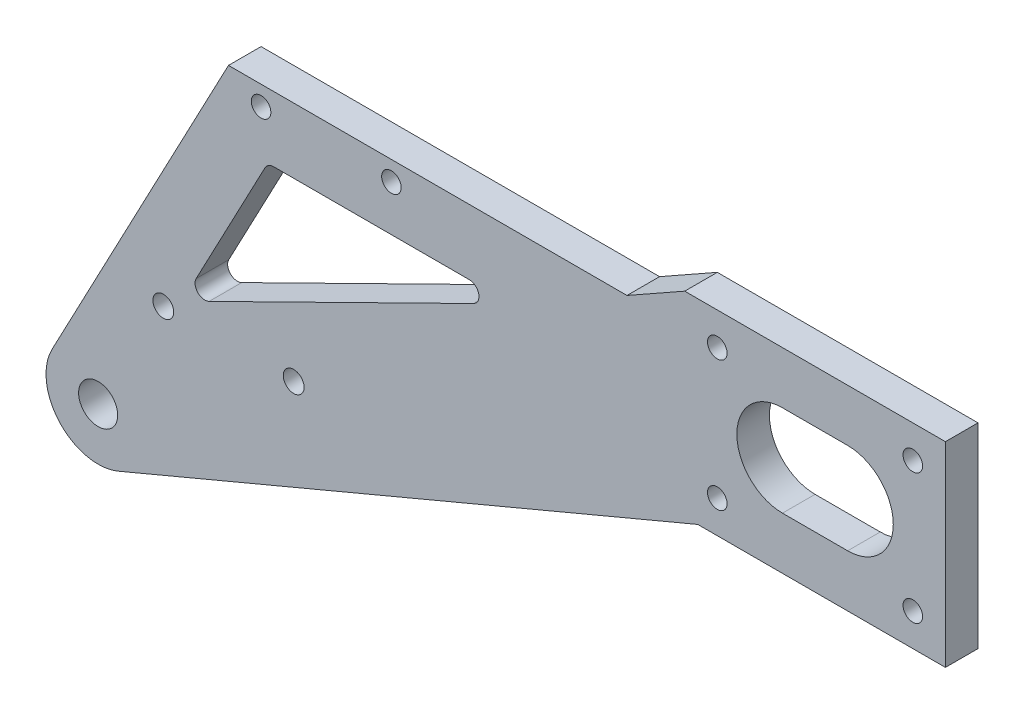
from build123d import *

# Parameters (mm, degrees)
SKETCH_1_R          = 3
SKETCH_1_R_2        = 1.5
EXTRUDE_1_DEPTH     = 5
EXTRUDE_2_DEPTH     = 5
SKETCH_4_R          = 1.5
CUT_EXTRUDE_1_DEPTH = 144.265487819
EXTRUDE_START       = -5
EXTRUDE_3_DEPTH     = 5
CUT_EXTRUDE_2_DEPTH = 144.265487819
SKETCH_7_R          = 1.6
CUT_EXTRUDE_3_DEPTH = 144.265487819


with BuildPart() as part:
    # 草图1 → 凸台-拉伸1 (new body)
    with BuildSketch(Plane.XY):
        with BuildLine():
            Line((-3.933140204, 6.966376973), (90, 60))
            Line((90, 60), (130, 60))
            Line((130, 60), (130, 30))
            Line((130, 30), (92, 30))
            Line((92, 30), (3.100465808, -7.374761811))
            ThreePointArc((3.100465808, -7.374761811), (-7.182645896, -3.522725923), (-3.933140204, 6.966376973))
        make_face()
        Circle(SKETCH_1_R, mode=Mode.SUBTRACT)
        with Locations((95, 55)):
            Circle(SKETCH_1_R_2, mode=Mode.SUBTRACT)
        with Locations((125, 55)):
            Circle(SKETCH_1_R_2, mode=Mode.SUBTRACT)
        with Locations((125, 35)):
            Circle(SKETCH_1_R_2, mode=Mode.SUBTRACT)
        with Locations((95, 35)):
            Circle(SKETCH_1_R_2, mode=Mode.SUBTRACT)
    extrude(amount=EXTRUDE_1_DEPTH)

    # 草图3 → 凸台-拉伸2 (add)
    with BuildSketch(Plane.XY.offset(5)):
        Polygon((81.144001216, 55), (20, 55), (20, 20.478766027), align=None)
    extrude(amount=-EXTRUDE_2_DEPTH)

    # 草图4 → 切除-拉伸1 (cut, through all)
    with BuildSketch(Plane.XY.offset(5)):
        with Locations((25, 52)):
            Circle(SKETCH_4_R)
        with Locations((45, 52)):
            Circle(SKETCH_4_R)
    extrude(amount=-CUT_EXTRUDE_1_DEPTH, mode=Mode.SUBTRACT)

    # 草图6 → 凸台-拉伸3 (add)
    with BuildSketch(Plane.XY.offset(5).offset(EXTRUDE_START)):
        with BuildLine():
            Line((-7.074049095, 3.736017853), (20, 55))
            Line((20, 55), (20, 20.478766027))
            Line((20, 20.478766027), (-3.933140204, 6.966376973))
            ThreePointArc((-3.933140204, 6.966376973), (-5.735709118, 5.576884517), (-7.074049095, 3.736017853))
        make_face()
    extrude(amount=EXTRUDE_3_DEPTH)

    # 草图5 → 切除-拉伸2 (cut, through all)
    with BuildSketch(Plane.XY.offset(5)):
        with BuildLine():
            Line((105, 52), (115, 52))
            ThreePointArc((115, 52), (122, 45), (115, 38))
            Line((115, 38), (105, 38))
            ThreePointArc((105, 38), (98, 45), (105, 52))
        make_face()
        with BuildLine():
            Line((25.605401824, 44.200503347), (15.042800964, 24.200503347))
            ThreePointArc((15.042800964, 24.200503347), (15.293877797, 22.454192152), (17.032531201, 22.154647985))
            Line((17.032531201, 22.154647985), (57.595132061, 42.154647985))
            ThreePointArc((57.595132061, 42.154647985), (58.392612512, 43.840567158), (56.93178603, 45))
            Line((56.93178603, 45), (26.93178603, 45))
            ThreePointArc((26.93178603, 45), (26.157433081, 44.784670195), (25.605401824, 44.200503347))
        make_face()
    extrude(amount=-CUT_EXTRUDE_2_DEPTH, mode=Mode.SUBTRACT)

    # 草图7 → 切除-拉伸3 (cut, through all)
    with BuildSketch(Plane.XY.offset(5)):
        with Locations((10, 18)):
            Circle(SKETCH_7_R)
        with Locations((30, 18)):
            Circle(SKETCH_7_R)
    extrude(amount=-CUT_EXTRUDE_3_DEPTH, mode=Mode.SUBTRACT)


solid = part.part
